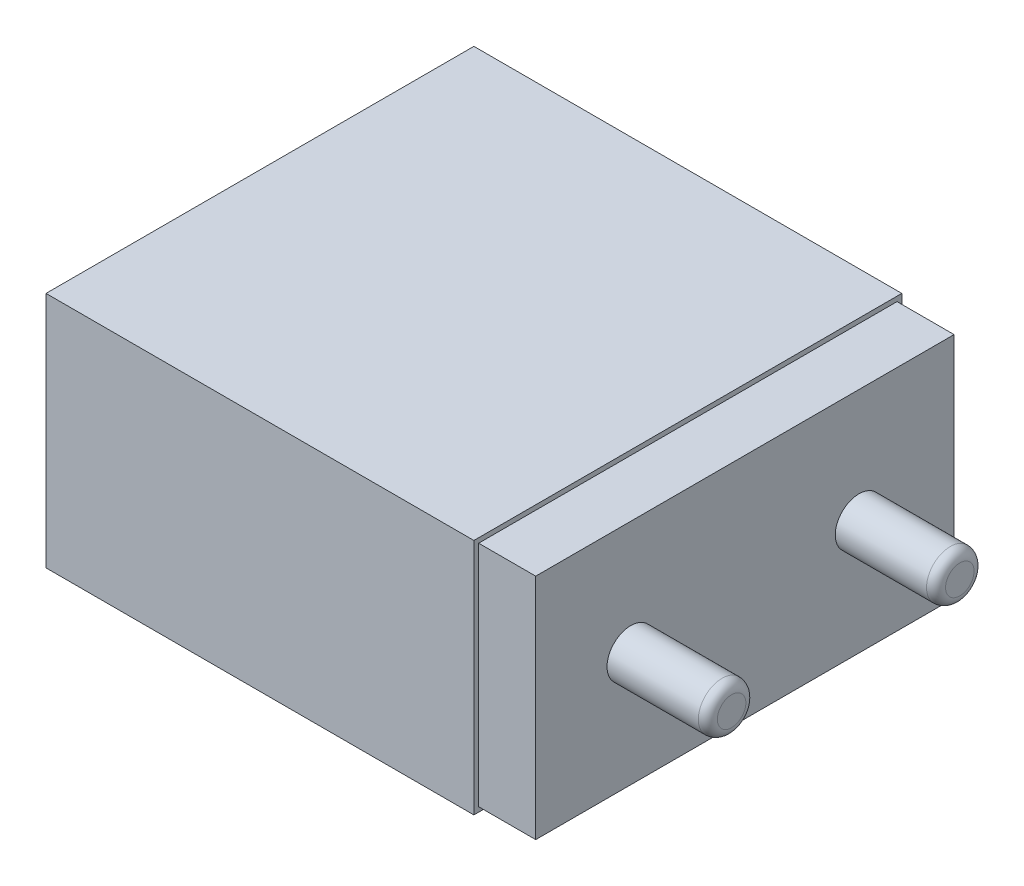
from build123d import *

# Parameters (mm, degrees)
SKETCH1_W           = 45
SKETCH1_H           = 45
BOSS_EXTRUDE1_DEPTH = 25
SKETCH2_W           = 44
SKETCH2_H           = 24
BOSS_EXTRUDE2_DEPTH = 6
SKETCH3_R           = 2.5
BOSS_EXTRUDE3_DEPTH = 10.6
FILLET12_R          = 1
FILLET13_R          = 1
SKETCH4_W           = 5
SKETCH4_H           = 10.5
CUT_EXTRUDE1_DEPTH  = 10.5
SKETCH5_W           = 15
SKETCH5_H           = 10.5
BOSS_EXTRUDE4_DEPTH = 0.5
FILLET14_R          = 0.1


with BuildPart() as part:
    # Sketch1 → Boss-Extrude1 (new body)
    with BuildSketch(Plane(origin=(0, 0, 0), x_dir=(1, 0, 0), z_dir=(0, 1, 0))):
        with Locations((-3.078947368, 6.710526316)):
            Rectangle(SKETCH1_W, SKETCH1_H)
    extrude(amount=BOSS_EXTRUDE1_DEPTH)

    # Sketch2 → Boss-Extrude2 (add)
    with BuildSketch(Plane(origin=(19.421052632, 0, 0), x_dir=(0, 0, -1), z_dir=(1, 0, 0))):
        with Locations((6.710526316, 12.5)):
            Rectangle(SKETCH2_W, SKETCH2_H)
    extrude(amount=BOSS_EXTRUDE2_DEPTH)

    # Sketch3 → Boss-Extrude3 (add)
    with BuildSketch(Plane(origin=(25.421052632, 0, 0), x_dir=(0, 0, -1), z_dir=(1, 0, 0))):
        with Locations((18.710526316, 12.5)):
            Circle(SKETCH3_R)
        with Locations((-5.289473684, 12.5)):
            Circle(SKETCH3_R)
    extrude(amount=BOSS_EXTRUDE3_DEPTH)

    # Fillet12
    fillet12_edges = [part.edges().sort_by_distance(p)[0] for p in [
        (36.021052632, 12.5, 7.789473684),
    ]]
    fillet(fillet12_edges, radius=FILLET12_R)

    # Fillet13
    fillet13_edges = [part.edges().sort_by_distance(p)[0] for p in [
        (36.021052632, 12.5, -16.210526316),
    ]]
    fillet(fillet13_edges, radius=FILLET13_R)

    # Sketch4 → Cut-Extrude1 (cut)
    with BuildSketch(Plane.ZY.offset(25.578947368)):
        with Locations((-21.710526316, 13.203091604)):
            Rectangle(SKETCH4_W, SKETCH4_H)
        with Locations((-11.710526316, 13.203091604)):
            Rectangle(SKETCH4_W, SKETCH4_H)
    extrude(amount=-CUT_EXTRUDE1_DEPTH, mode=Mode.SUBTRACT)

    # Sketch5 → Boss-Extrude4 (add)
    with BuildSketch(Plane.ZY.offset(25.578947368)):
        with Locations((3.289473684, 13.203091604)):
            Rectangle(SKETCH5_W, SKETCH5_H)
    extrude(amount=BOSS_EXTRUDE4_DEPTH)

    # Fillet14
    fillet14_edges = [part.edges().sort_by_distance(p)[0] for p in [
        (-26.078947368, 13.203091604, -4.210526316),
        (-26.078947368, 7.953091604, 3.289473684),
        (-26.078947368, 13.203091604, 10.789473684),
        (-26.078947368, 18.453091604, 3.289473684),
    ]]
    fillet(fillet14_edges, radius=FILLET14_R)


solid = part.part
